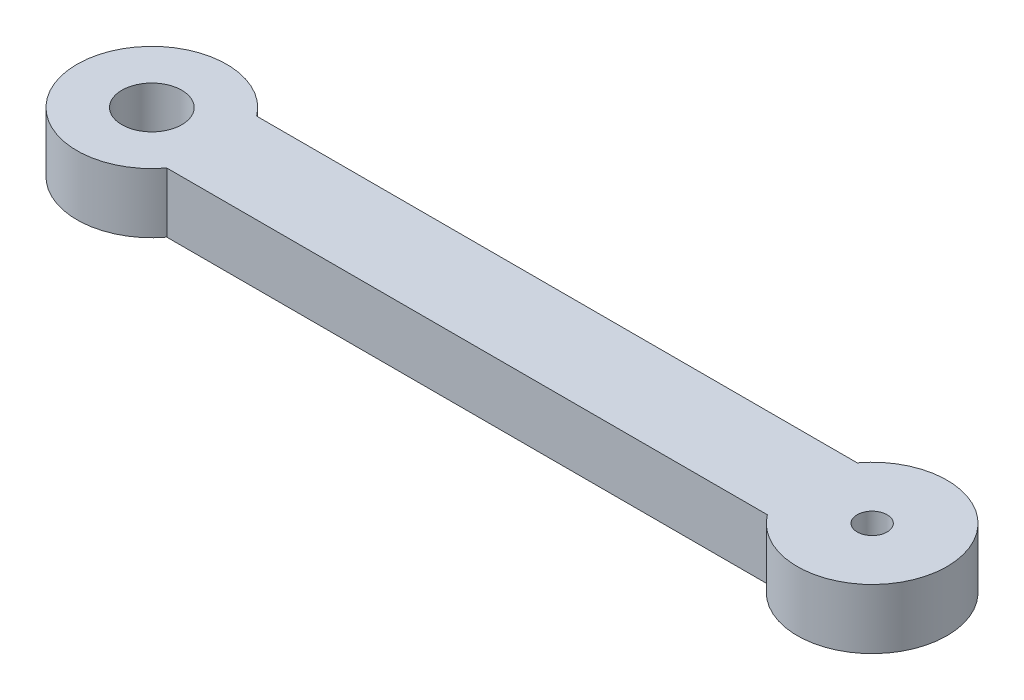
from build123d import *

# Parameters (mm, degrees)
SKETCH1_R           = 0.5
SKETCH1_R_2         = 1
BOSS_EXTRUDE1_DEPTH = 2


with BuildPart() as part:
    # Sketch1 → Boss-Extrude1 (new body)
    with BuildSketch(Plane(origin=(0, 0, 0), x_dir=(1, 0, 0), z_dir=(0, 1, 0))):
        with BuildLine():
            Line((-10.025, 1.5), (10.025, 1.5))
            ThreePointArc((10.025, 1.5), (14.525, 0), (10.025, -1.5))
            Line((10.025, -1.5), (-10.025, -1.5))
            ThreePointArc((-10.025, -1.5), (-14.525, 0), (-10.025, 1.5))
        make_face()
        with Locations(Location((12.025, 0, 0), (0, 0, 270))):
            Circle(SKETCH1_R, mode=Mode.SUBTRACT)
        with Locations(Location((-12.025, 0, 0), (0, 0, 270))):
            Circle(SKETCH1_R_2, mode=Mode.SUBTRACT)
    extrude(amount=BOSS_EXTRUDE1_DEPTH)


solid = part.part
